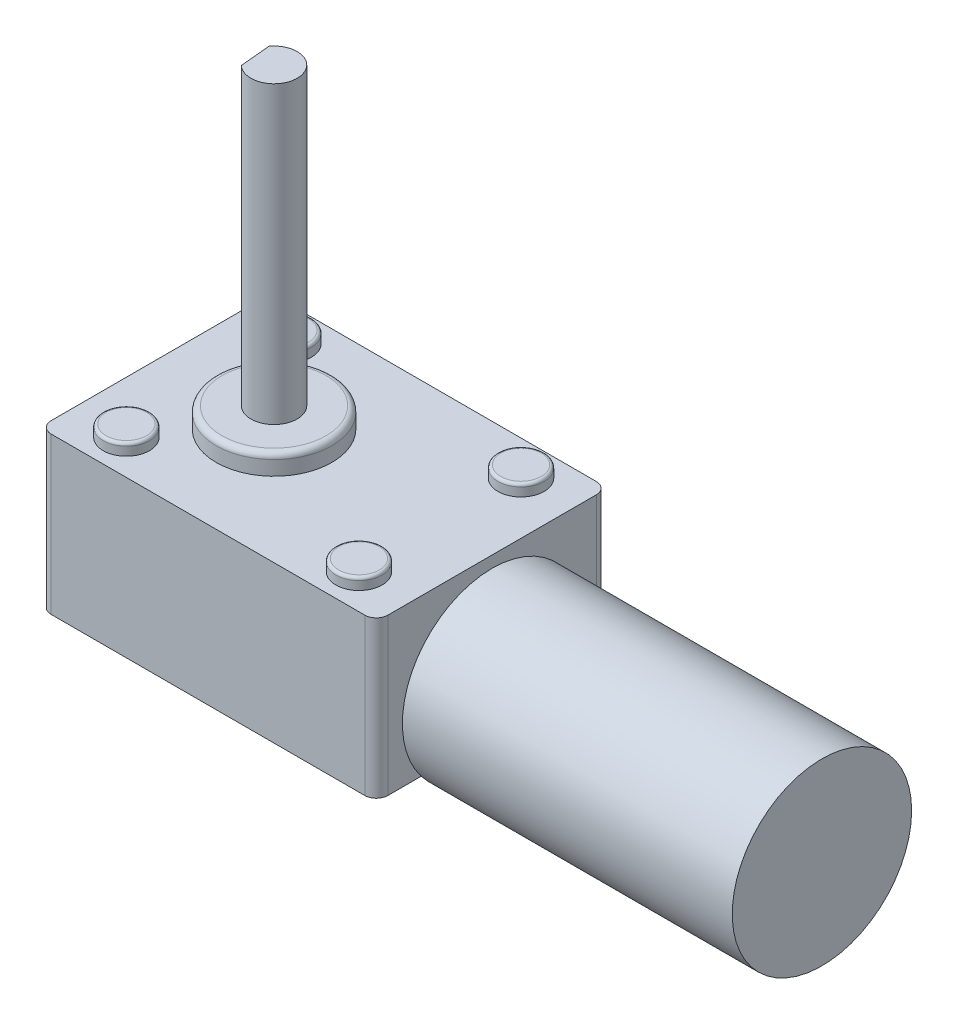
from build123d import *

# Parameters (mm, degrees)
SKETCH1_W           = 58.2
SKETCH1_H           = 40
BOSS_EXTRUDE1_DEPTH = 27
FILLET1_R           = 2
SKETCH2_R           = 15.5
BOSS_EXTRUDE2_DEPTH = 57
SKETCH3_R           = 4
BOSS_EXTRUDE3_DEPTH = 2
SKETCH4_R           = 10
BOSS_EXTRUDE4_DEPTH = 3.5
FILLET2_R           = 0.5
FILLET3_R           = 1
FILLET4_R           = 0.5
FILLET5_R           = 1
BOSS_EXTRUDE5_DEPTH = 51


with BuildPart() as part:
    # Sketch1 → Boss-Extrude1 (new body)
    with BuildSketch(Plane(origin=(0, 0, 0), x_dir=(1, 0, 0), z_dir=(0, 1, 0))):
        with Locations((-36.950232558, 6.122325581)):
            Rectangle(SKETCH1_W, SKETCH1_H)
    extrude(amount=BOSS_EXTRUDE1_DEPTH)

    # Fillet1
    fillet1_edges = [part.edges().sort_by_distance(p)[0] for p in [
        (-66.050232558, 13.5, -26.122325581),
        (-7.850232558, 13.5, -26.122325581),
        (-7.850232558, 13.5, 13.877674419),
        (-66.050232558, 13.5, 13.877674419),
    ]]
    fillet(fillet1_edges, radius=FILLET1_R)

    # Sketch2 → Boss-Extrude2 (add)
    with BuildSketch(Plane(origin=(-7.850232558, 0, 0), x_dir=(0, 0, -1), z_dir=(1, 0, 0))):
        with Locations(Location((6.122325581, 9.5, 0), (0, 0, 217.799722435))):
            Circle(SKETCH2_R)
    extrude(amount=BOSS_EXTRUDE2_DEPTH)

    # Sketch3 → Boss-Extrude3 (add)
    with BuildSketch(Plane(origin=(0, 27, 0), x_dir=(1, 0, 0), z_dir=(0, 1, 0))):
        with Locations(Location((-16.850232558, -7.877674419, 0), (0, 0, 270))):
            Circle(SKETCH3_R)
        with Locations(Location((-16.850232558, 20.122325581, 0), (0, 0, 270))):
            Circle(SKETCH3_R)
        with Locations(Location((-57.050232558, -7.877674419, 0), (0, 0, 270))):
            Circle(SKETCH3_R)
        with Locations(Location((-57.050232558, 20.122325581, 0), (0, 0, 270))):
            Circle(SKETCH3_R)
    boss_extrude3 = extrude(amount=BOSS_EXTRUDE3_DEPTH)

    # Sketch4 → Boss-Extrude4 (add)
    with BuildSketch(Plane(origin=(0, 27, 0), x_dir=(1, 0, 0), z_dir=(0, 1, 0))):
        with Locations(Location((-45.529984773, 6.122325581, 0), (0, 0, 270))):
            Circle(SKETCH4_R)
    boss_extrude4 = extrude(amount=BOSS_EXTRUDE4_DEPTH)

    # Mirror1: Boss-Extrude3, Boss-Extrude4 across plane
    add(boss_extrude3.mirror(Plane.ZX.offset(13.5)))
    add(boss_extrude4.mirror(Plane.ZX.offset(13.5)))

    # Fillet2
    fillet2_edges = [part.edges().sort_by_distance(p)[0] for p in [
        (-16.850232558, 29, 3.877674419),
        (-16.850232558, 29, -24.122325581),
        (-57.050232558, 29, 3.877674419),
        (-57.050232558, 29, -24.122325581),
    ]]
    fillet(fillet2_edges, radius=FILLET2_R)

    # Fillet3
    fillet3_edges = [part.edges().sort_by_distance(p)[0] for p in [
        (-45.529984773, 30.5, -16.122325581),
    ]]
    fillet(fillet3_edges, radius=FILLET3_R)

    # Mirror6: Boss-Extrude3, Boss-Extrude4 across plane
    add(boss_extrude3.mirror(Plane.ZX.offset(13.5)))
    add(boss_extrude4.mirror(Plane.ZX.offset(13.5)))

    # Fillet4
    fillet4_edges = [part.edges().sort_by_distance(p)[0] for p in [
        (-16.850232558, -2, 3.877674419),
        (-16.850232558, -2, -24.122325581),
        (-57.050232558, -2, 3.877674419),
        (-57.050232558, -2, -24.122325581),
    ]]
    fillet(fillet4_edges, radius=FILLET4_R)

    # Fillet5
    fillet5_edges = [part.edges().sort_by_distance(p)[0] for p in [
        (-45.529984773, -3.5, -16.122325581),
    ]]
    fillet(fillet5_edges, radius=FILLET5_R)

    # Sketch5 → Boss-Extrude5 (add)
    with BuildSketch(Plane(origin=(0, 30.5, 0), x_dir=(1, 0, 0), z_dir=(0, 1, 0))):
        with BuildLine():
            Line((-48.270431405, 3.208573317), (-48.763439554, 8.47705915))
            ThreePointArc((-48.763439554, 8.47705915), (-41.54738383, 6.495004712), (-48.270431405, 3.208573317))
        make_face()
    extrude(amount=BOSS_EXTRUDE5_DEPTH)


solid = part.part
